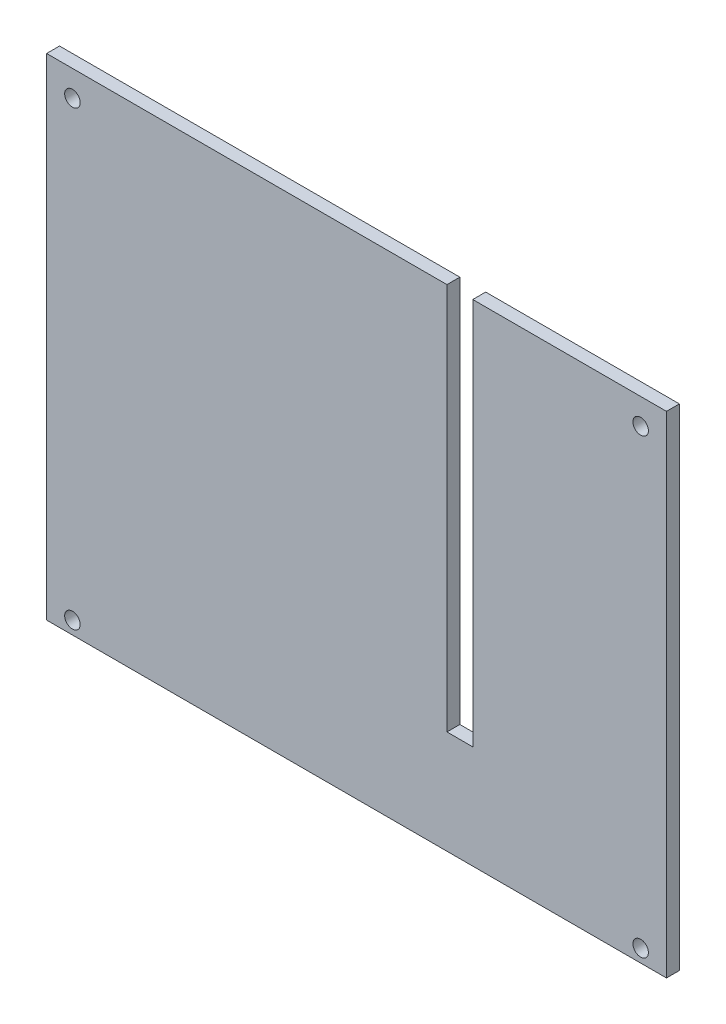
from build123d import *

# Parameters (mm, degrees)
ESQUISSE1_W             = 240
ESQUISSE1_H             = 190
BOSS_EXTRU_1_DEPTH      = 5
ESQUISSE2_W             = 10
ESQUISSE2_H             = 150
ENL_V_MAT_EXTRU_1_DEPTH = 5
ESQUISSE3_R             = 3
ENL_V_MAT_EXTRU_2_DEPTH = 10


with BuildPart() as part:
    # Esquisse1 → Boss.-Extru.1 (new body)
    with BuildSketch(Plane.XY):
        with Locations((120, -95)):
            Rectangle(ESQUISSE1_W, ESQUISSE1_H)
    extrude(amount=BOSS_EXTRU_1_DEPTH)

    # Esquisse2 → Enlèv. mat.-Extru.1 (cut)
    with BuildSketch(Plane.XY.offset(5)):
        with Locations((160, -75)):
            Rectangle(ESQUISSE2_W, ESQUISSE2_H)
    extrude(amount=-ENL_V_MAT_EXTRU_1_DEPTH, mode=Mode.SUBTRACT)

    # Esquisse3 → Enlèv. mat.-Extru.2 (cut)
    with BuildSketch(Plane(origin=(0, 0, 0), x_dir=(-1, 0, 0), z_dir=(0, 0, -1))):
        with Locations((-10, -185)):
            Circle(ESQUISSE3_R)
        with Locations((-10, -10)):
            Circle(ESQUISSE3_R)
        with Locations(Location((-230, -185, 0), (0, 0, 180))):
            Circle(ESQUISSE3_R)
        with Locations(Location((-230, -10, 0), (0, 0, 180))):
            Circle(ESQUISSE3_R)
    extrude(amount=-ENL_V_MAT_EXTRU_2_DEPTH, mode=Mode.SUBTRACT)


solid = part.part
